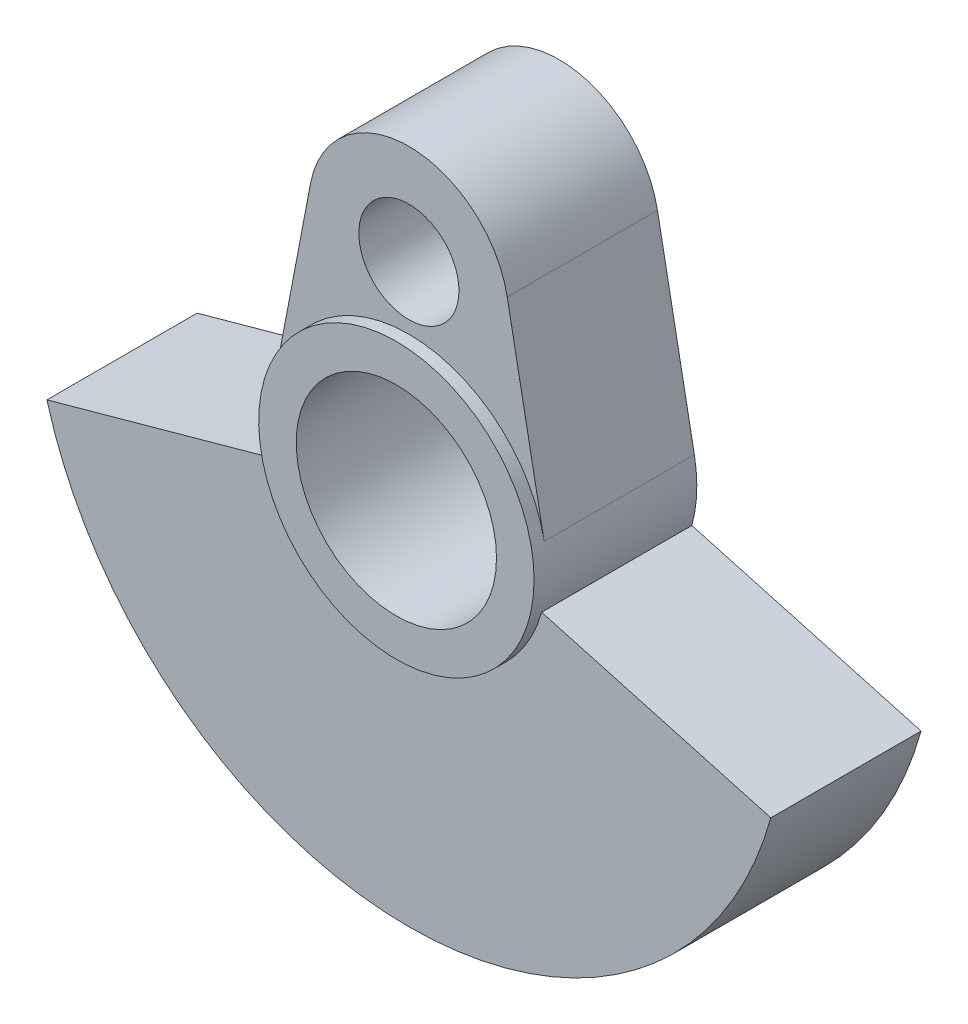
from build123d import *
from build123d.topology import SkipClean

# Parameters (mm, degrees)
SKETCH1_R           = 2
SKETCH1_R_2         = 4
BOSS_EXTRUDE1_DEPTH = 6
BOSS_EXTRUDE2_START = -6
BOSS_EXTRUDE2_DEPTH = 6
SKETCH3_R           = 5.5
SKETCH3_R_2         = 4
BOSS_EXTRUDE4_DEPTH = 0.5


with BuildPart() as part:
    # Sketch1 → Boss-Extrude1 (new body)
    with BuildSketch(Plane.XY):
        with BuildLine():
            Line((-5.402455316, -6.96875), (-3.929058411, 0.75))
            ThreePointArc((-3.929058411, 0.75), (0, 4), (3.929058411, 0.75))
            Line((3.929058411, 0.75), (5.402455316, -6.96875))
            ThreePointArc((5.402455316, -6.96875), (0, -13.5), (-5.402455316, -6.96875))
        make_face()
        Circle(SKETCH1_R, mode=Mode.SUBTRACT)
        with Locations((0, -8)):
            Circle(SKETCH1_R_2, mode=Mode.SUBTRACT)
    extrude(amount=BOSS_EXTRUDE1_DEPTH)

    # Sketch2 → Boss-Extrude2 (add)
    with BuildSketch(Plane.XY.offset(6).offset(BOSS_EXTRUDE2_START)):
        with BuildLine():
            Line((0, -13.5), (0, -23))
            ThreePointArc((0, -23), (9.082951062, -19.937336386), (14.456832295, -12))
            Line((14.456832295, -12), (5.300838508, -9.466666667))
            ThreePointArc((5.300838508, -9.466666667), (3.33041539, -12.377023342), (0, -13.5))
        make_face()
        with BuildLine():
            Line((-5.300838508, -9.466666667), (-14.456832295, -12))
            ThreePointArc((-14.456832295, -12), (-9.082951062, -19.937336386), (0, -23))
            Line((0, -23), (0, -13.5))
            ThreePointArc((0, -13.5), (-3.33041539, -12.377023342), (-5.300838508, -9.466666667))
        make_face()
    extrude(amount=BOSS_EXTRUDE2_DEPTH)

    # Sketch3 → Boss-Extrude4 (add)
    with SkipClean():  # the faces are left unmerged after this step: merging them gives an invalid solid
        with BuildSketch(Plane.XY.offset(6)):
            with Locations(Location((0, -8, 0), (0, 0, 169.193077125))):
                Circle(SKETCH3_R)
            with Locations((0, -8)):
                Circle(SKETCH3_R_2, mode=Mode.SUBTRACT)
        extrude(amount=BOSS_EXTRUDE4_DEPTH)


solid = part.part
